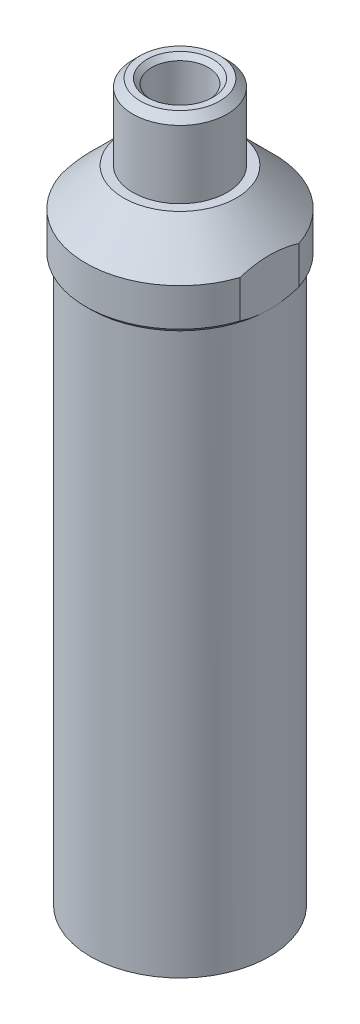
from build123d import *

# Parameters (mm, degrees)
SKIZZE3_W                       = 5
SKIZZE3_H                       = 23
SCHNITT_LINEAR_AUSTRAGEN1_DEPTH = 9
FASE1_SIZE                      = 0.5


with BuildPart() as part:
    # Skizze2 → Rotation1 (revolve)
    with BuildSketch(Plane(origin=(0, 0, 0), x_dir=(0, 0, -1), z_dir=(1, 0, 0)), mode=Mode.PRIVATE) as rotation1_sk:
        Polygon((3, 38), (3, -38), (9.5, -38), (9.5, 21.5), (10, 22), (10, 26), (6, 30), (5, 30), (5, 37.2), (4.2, 38), align=None)
    revolve(rotation1_sk.sketch.rotate(Axis((0, 40.422682589, 0), (0, -1, 0)), 180), axis=Axis((0, 40.422682589, 0), (0, -1, 0)))

    # Skizze3 → Schnitt-Linear austragen1 (cut)
    with BuildSketch(Plane(origin=(0, 30, 0), x_dir=(1, 0, 0), z_dir=(0, 1, 0))):
        with Locations((12, 0)):
            Rectangle(SKIZZE3_W, SKIZZE3_H)
        with Locations((-12, 0)):
            Rectangle(SKIZZE3_W, SKIZZE3_H)
    extrude(amount=-SCHNITT_LINEAR_AUSTRAGEN1_DEPTH, mode=Mode.SUBTRACT)

    # Fase1
    fase1_edges = [part.edges().sort_by_distance(p)[0] for p in [
        (0, 38, -3),
    ]]
    chamfer(fase1_edges, length=FASE1_SIZE)


solid = part.part
